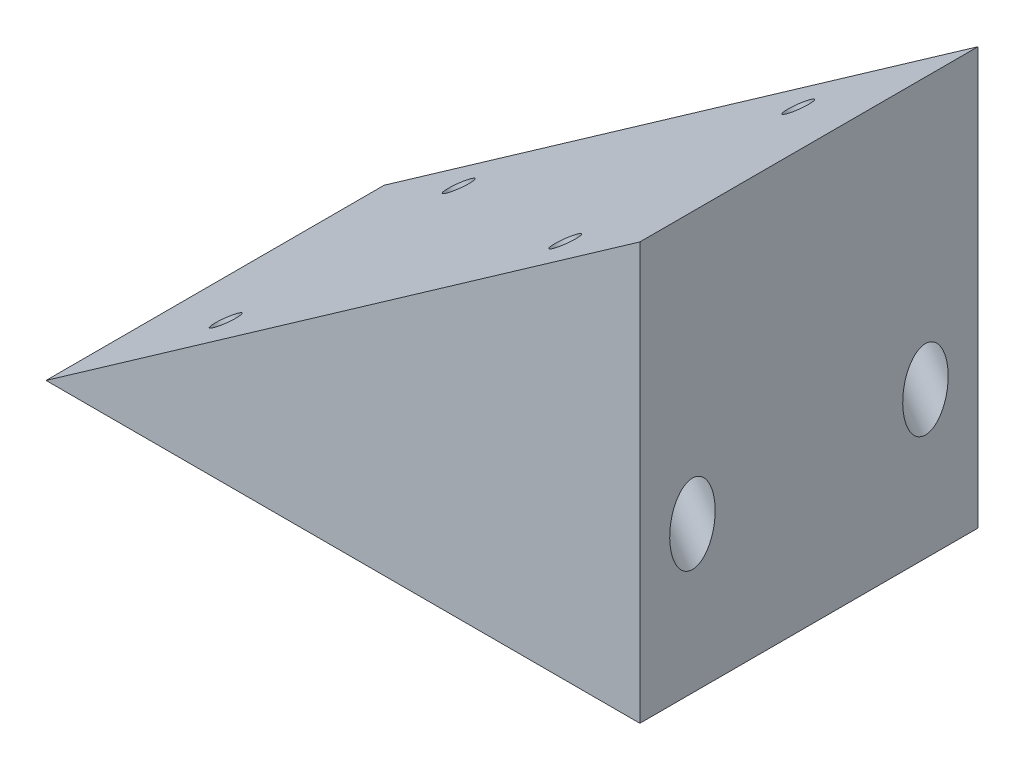
from build123d import *

# Parameters (mm, degrees)
SKETCH1_W                     = 104.5
SKETCH1_H                     = 59.5
BOSS_EXTRUDE1_DEPTH           = 73.36
CUT_EXTRUDE2_DEPTH            = 108.944439875
CBORE_FOR_M4_SHCS1_AT_2_COUNT = 2
CBORE_FOR_M4_SHCS1_AT_2_PITCH = 73
CBORE_FOR_M4_SHCS1_AT_3_COUNT = 2
CBORE_FOR_M4_SHCS1_AT_3_PITCH = 83.725742756
CBORE_FOR_M4_SHCS1_AT_4_COUNT = 2
CBORE_FOR_M4_SHCS1_AT_4_PITCH = 41


with BuildPart() as part:
    # Sketch1 → Boss-Extrude1 (new body)
    with BuildSketch(Plane(origin=(0, 0, 0), x_dir=(1, 0, 0), z_dir=(0, 1, 0))):
        Rectangle(SKETCH1_W, SKETCH1_H)
    extrude(amount=BOSS_EXTRUDE1_DEPTH)

    # Sketch6 → Cut-Extrude2 (cut, through all)
    with BuildSketch(Plane.XY.offset(29.75)):
        Polygon((-52.25, 0), (52.25, 73.36), (-52.25, 73.36), align=None)
    extrude(amount=-CUT_EXTRUDE2_DEPTH, mode=Mode.SUBTRACT)

    # Sketch9 → CBORE for M4 SHCS1 (revolve, cut)
    with BuildSketch(Plane(origin=(-1.145450259, -25.214571197, -20.5), x_dir=(0.8184584759172453, 0.5745656822324319, 0), z_dir=(0, 0, 1))):
        Polygon((0, 0), (0, 110.042113793), (2.25, 110.042113793), (2.25, 44), (4, 44), (4, 0.020977491), (4.025, 0), align=None)
    cbore_for_m4_shcs1 = revolve(axis=Axis((2.503041823, -30.411782519, -20.5), (-0.5745656822324319, 0.8184584759172453, 0)), mode=Mode.SUBTRACT)

    # CBORE for M4 SHCS1 at 2: CBORE for M4 SHCS1 ×2
    with Locations(*[Vector(0.8184584759172454, 0.5745656822324319, 0) * (i * CBORE_FOR_M4_SHCS1_AT_2_PITCH) for i in range(1, CBORE_FOR_M4_SHCS1_AT_2_COUNT)]):
        add(cbore_for_m4_shcs1, mode=Mode.SUBTRACT)

    # CBORE for M4 SHCS1 at 3: CBORE for M4 SHCS1 ×2
    with Locations(*[Vector(0.7136093007411902, 0.5009605579174519, 0.48969407317906627) * (i * CBORE_FOR_M4_SHCS1_AT_3_PITCH) for i in range(1, CBORE_FOR_M4_SHCS1_AT_3_COUNT)]):
        add(cbore_for_m4_shcs1, mode=Mode.SUBTRACT)

    # CBORE for M4 SHCS1 at 4: CBORE for M4 SHCS1 ×2
    with Locations(*[(0, 0, i * CBORE_FOR_M4_SHCS1_AT_4_PITCH) for i in range(1, CBORE_FOR_M4_SHCS1_AT_4_COUNT)]):
        add(cbore_for_m4_shcs1, mode=Mode.SUBTRACT)


solid = part.part
